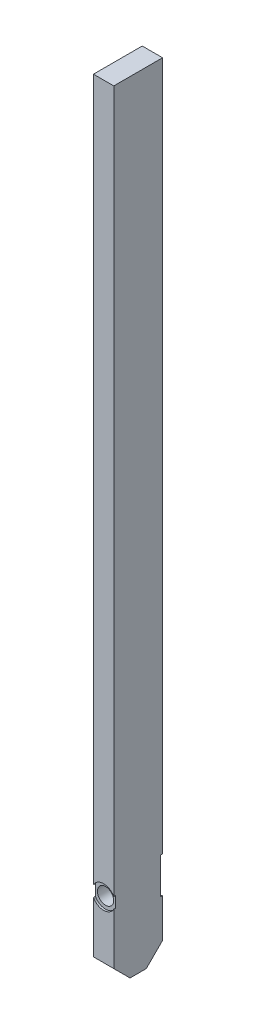
from build123d import *

# Parameters (mm, degrees)
SKETCH1_W           = 38.1
SKETCH1_H           = 609.6
BOSS_EXTRUDE1_DEPTH = 15.875
SKETCH2_R           = 4.7625
CUT_EXTRUDE1_DEPTH  = 308.581965702
SKETCH3_R           = 6.35
CUT_EXTRUDE2_DEPTH  = 19.431
CHAMFER1_SIZE       = 12.7
SKETCH4_R           = 16.1925
CUT_EXTRUDE3_DEPTH  = 1.778
SKETCH5_R           = 9.017
CUT_EXTRUDE4_DEPTH  = 1.524
SKETCH6_R           = 0.762
CUT_EXTRUDE5_DEPTH  = 12.7


with BuildPart() as part:
    # Sketch1 → Boss-Extrude1 (new body)
    with BuildSketch(Plane(origin=(0, 0, 0), x_dir=(0, 0, -1), z_dir=(1, 0, 0))):
        Rectangle(SKETCH1_W, SKETCH1_H)
    extrude(amount=BOSS_EXTRUDE1_DEPTH)

    # Sketch2 → Cut-Extrude1 (cut, through all)
    with BuildSketch(Plane.XY.offset(19.05)):
        with Locations((7.9375, -247.65)):
            Circle(SKETCH2_R)
    extrude(amount=-CUT_EXTRUDE1_DEPTH, mode=Mode.SUBTRACT)

    # Sketch3 → Cut-Extrude2 (cut)
    with BuildSketch(Plane.XY.offset(19.05)):
        with Locations((7.9375, -247.65)):
            Circle(SKETCH3_R)
    extrude(amount=-CUT_EXTRUDE2_DEPTH, mode=Mode.SUBTRACT)

    # Chamfer1
    chamfer1_edges = [part.edges().sort_by_distance(p)[0] for p in [
        (7.9375, -304.8, -19.05),
        (7.9375, -304.8, 19.05),
    ]]
    chamfer(chamfer1_edges, length=CHAMFER1_SIZE)

    # Sketch4 → Cut-Extrude3 (cut)
    with BuildSketch(Plane(origin=(0, 0, -19.05), x_dir=(-1, 0, 0), z_dir=(0, 0, -1))):
        with Locations((-7.9375, -247.65)):
            Circle(SKETCH4_R)
    extrude(amount=-CUT_EXTRUDE3_DEPTH, mode=Mode.SUBTRACT)

    # Sketch5 → Cut-Extrude4 (cut)
    with BuildSketch(Plane.XY.offset(19.05)):
        with Locations((7.9375, -247.65)):
            Circle(SKETCH5_R)
    extrude(amount=-CUT_EXTRUDE4_DEPTH, mode=Mode.SUBTRACT)

    # Sketch6 → Cut-Extrude5 (cut)
    with BuildSketch(Plane(origin=(0, 0, -17.272), x_dir=(-1, 0, 0), z_dir=(0, 0, -1))):
        with Locations(Location((-7.9375, -235.331, 0), (0, 0, 90))):
            Circle(SKETCH6_R)
    extrude(amount=-CUT_EXTRUDE5_DEPTH, mode=Mode.SUBTRACT)


solid = part.part
